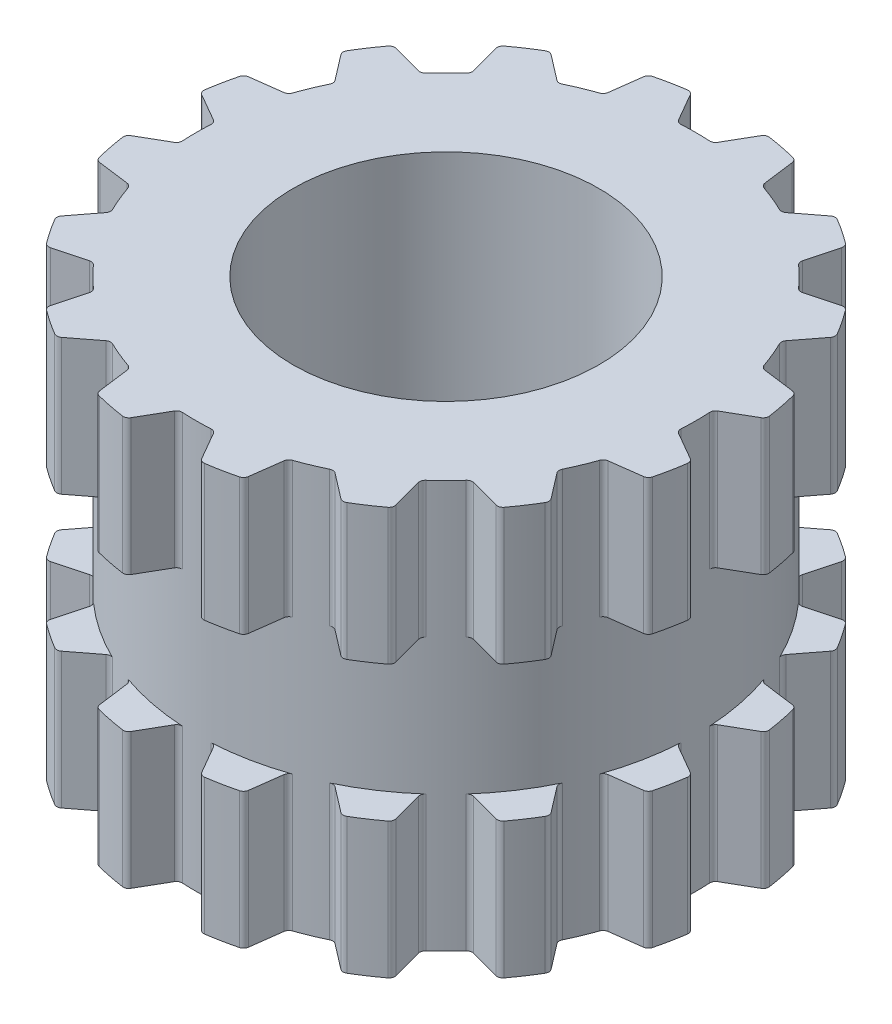
from build123d import *
from build123d.topology import SkipClean

# Parameters (mm, degrees)
BODYS_W               = 2
BODYS_H               = 3
M3X0_5_TAPPED_HOLE1_D = 2.5
MIDBODYCUTS_W         = 0.25
MIDBODYCUTS_H         = 1
GROOVECUT_DEPTH       = 4.201562119
GCCP_COUNT            = 16
SCALE1_SCALE_X        = 1.4
SCALE1_SCALE_Y        = 1.333
SCALE1_SCALE_Z        = 1.4
SKETCH4_R             = 1.75
SKETCH4_R_2           = 1.5
BOSS_EXTRUDE1_DEPTH   = 3.999
SCALE2_SCALE          = 0.667


with BuildPart() as part:
    # BodyS → Body (revolve)
    with BuildSketch(Plane.XY, mode=Mode.PRIVATE) as body_sk:
        with Locations((1, 0)):
            Rectangle(BODYS_W, BODYS_H)
    revolve(body_sk.sketch.rotate(Axis((0, -1.5, 0), (0, 1, 0)), 90), axis=Axis((0, -1.5, 0), (0, 1, 0)))

    # M3x0.5 Tapped Hole1 (through all)
    with Locations(Plane(origin=(0, 1.5, 0), x_dir=(1, 0, 0), z_dir=(0, 1, 0))):
        with Locations((0, 0)):
            Hole(M3X0_5_TAPPED_HOLE1_D / 2)

    # MidBodyCutS → MidBodyCut (revolve, cut)
    with BuildSketch(Plane.XY, mode=Mode.PRIVATE) as midbodycut_sk:
        with Locations((1.875, 0)):
            Rectangle(MIDBODYCUTS_W, MIDBODYCUTS_H)
    revolve(midbodycut_sk.sketch.rotate(Axis((0, 5.5, 0), (0, -1, 0)), 270), axis=Axis((0, 5.5, 0), (0, -1, 0)), mode=Mode.SUBTRACT)

    # GrooveCutS → GrooveCut (cut, symmetric)
    with SkipClean():  # the faces are left unmerged after this step: merging them gives an invalid solid
        with BuildSketch(Plane(origin=(0, 0, 0), x_dir=(1, 0, 0), z_dir=(0, 1, 0))):
            with BuildLine():
                Line((0.136871074, 1.767078346), (0.247975811, 1.959517396))
                ThreePointArc((0.247975811, 1.959517396), (0.265173181, 1.975513496), (0.288384518, 1.979099384))
                ThreePointArc((0.288384518, 1.979099384), (0, 2), (-0.288384518, 1.979099384))
                ThreePointArc((-0.288384518, 1.979099384), (-0.265173181, 1.975513496), (-0.247975811, 1.959517396))
                Line((-0.247975811, 1.959517396), (-0.136871074, 1.767078346))
                ThreePointArc((-0.136871074, 1.767078346), (-0.121232286, 1.751880117), (-0.099945587, 1.747143635))
                ThreePointArc((-0.099945587, 1.747143635), (0, 1.75), (0.099945587, 1.747143635))
                ThreePointArc((0.099945587, 1.747143635), (0.121232286, 1.751880117), (0.136871074, 1.767078346))
            make_face()
        groovecut = extrude(amount=GROOVECUT_DEPTH, both=True, mode=Mode.SUBTRACT)

    # GCCP: GrooveCut ×16 about axis
    with SkipClean():  # the faces are left unmerged after this step: merging them gives an invalid solid
        gccp_axis = Axis((0, 0, 0), (0, 1, 0))
        for i in range(1, GCCP_COUNT):
            add(groovecut.rotate(gccp_axis, i * 360 / GCCP_COUNT), mode=Mode.SUBTRACT)


with BuildPart() as part_1:
    # Scale1: scaled about (0, 0, 0)
    add(part.part.scale((SCALE1_SCALE_X, SCALE1_SCALE_Y, SCALE1_SCALE_Z), about=(0, 0, 0)))

    # Sketch4 → Boss-Extrude1 (add)
    with BuildSketch(Plane(origin=(0, 1.9995, 0), x_dir=(1, 0, 0), z_dir=(0, 1, 0))):
        Circle(SKETCH4_R)
        with Locations(Location((0, 0, 0), (0, 0, 270))):
            Circle(SKETCH4_R_2, mode=Mode.SUBTRACT)
    extrude(amount=-BOSS_EXTRUDE1_DEPTH)


with BuildPart() as part_2:
    # Scale2: scaled about (0, 0, 0)
    add(part_1.part.scale(SCALE2_SCALE))


solid = part_2.part
